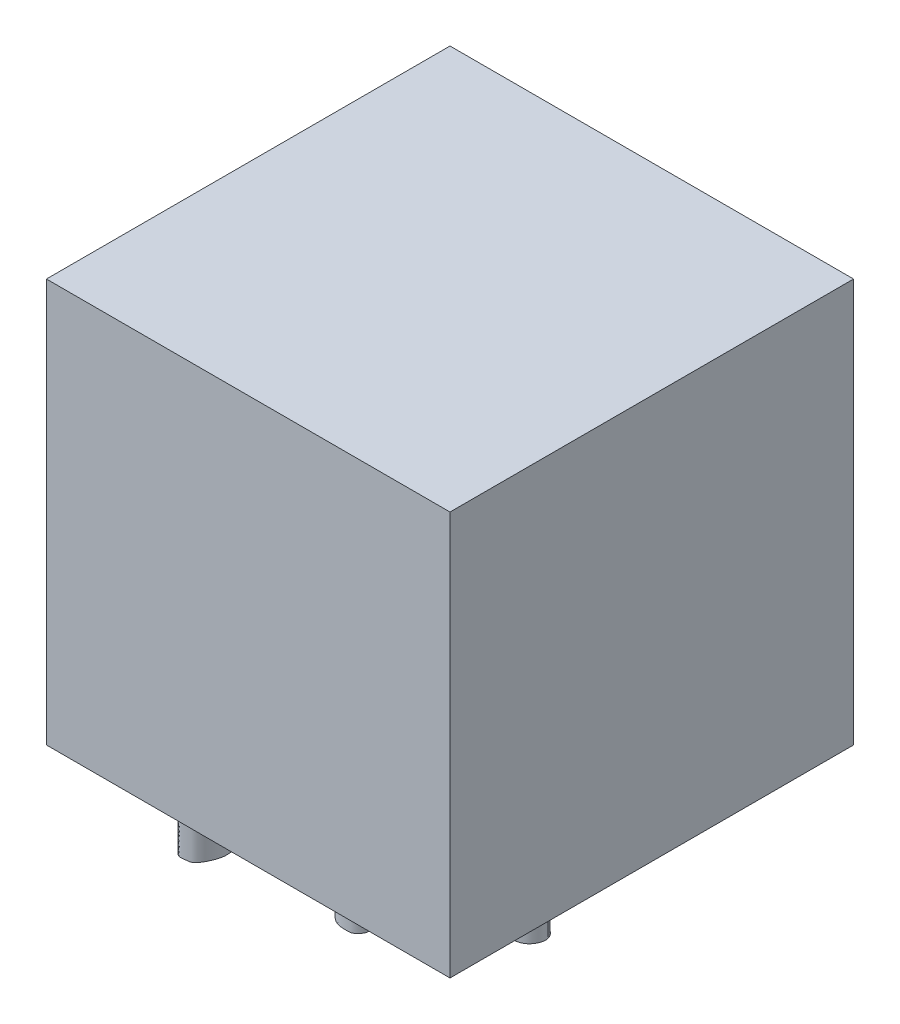
from build123d import *

# Parameters (mm, degrees)
SKETCH_1_W      = 30
SKETCH_1_H      = 30
EXTRUDE_1_DEPTH = 30
EXTRUDE_2_DEPTH = 3


with BuildPart() as part:
    # 草图1 → 凸台-拉伸1 (new body)
    with BuildSketch(Plane(origin=(0, 0, 0), x_dir=(1, 0, 0), z_dir=(0, 1, 0))):
        Rectangle(SKETCH_1_W, SKETCH_1_H)
    extrude(amount=EXTRUDE_1_DEPTH)

    # 草图2 → 凸台-拉伸2 (add)
    with BuildSketch(Plane.XZ):
        with BuildLine():
            add(Edge.make_bspline(
                [(-6.194597654, 13.82502505), (-6.166933702, 13.744211153), (-6.000916232, 13.631687004), (-5.771694041, 13.669888057), (-5.642382478, 13.506764366), (-5.427894123, 13.354814494), (-5.332082009, 12.99438775), (-5.203476733, 12.369186598), (-5.306627094, 11.403341407), (-5.456334531, 10.230728777), (-5.69960307, 9.09337539), (-5.932822276, 8.41426922), (-6.199867158, 7.999028357), (-6.40280031, 8.038345758), (-6.658277331, 7.995079883), (-7.021426722, 8.076449659), (-7.408439024, 8.027505013), (-7.71414718, 8.149523486), (-7.910002864, 8.058406525), (-8.079553236, 7.865646365), (-7.766876379, 7.762054775), (-7.473766919, 7.707967411), (-7.165725242, 7.463411988), (-6.686308156, 7.218412088), (-6.553977908, 6.662707223), (-6.773906248, 6.218736262), (-7.054140966, 5.763318364), (-7.35646497, 5.135256464), (-7.79101034, 4.440855154), (-8.141326234, 3.80352888), (-8.453730811, 3.338516564), (-8.807257688, 3.082811933), (-9.235826196, 3.284913926), (-9.574093218, 3.705609094), (-9.967244453, 3.893145757), (-10.117707695, 4.150088136), (-10.244248681, 4.080005387), (-10.278441945, 3.90990159), (-10.247445324, 3.581433709), (-10.116633768, 3.142025815), (-9.840949534, 2.695292524), (-9.826676945, 2.308098648), (-9.660812888, 1.985966336), (-9.98152047, 1.717987945), (-10.329139679, 1.423013606), (-10.647244937, 1.186169371), (-11.046705043, 0.790563905), (-10.677502971, 0.612401642), (-10.443443385, 0.487834453), (-10.154166276, 0.525237776), (-9.822886914, 0.551367922), (-9.496991679, 0.227987567), (-9.148977333, -0.43254628), (-9.163447934, -1.145586179), (-8.938423635, -2.001110377), (-9.463078147, -2.114888415), (-9.809303687, -2.203570605), (-10.136635919, -2.35927749), (-10.129903178, -2.637230759), (-9.954372946, -2.686217099), (-9.751809786, -2.785910936), (-9.378900775, -2.90802814), (-8.856952618, -3.017926375), (-8.759285569, -3.467117867), (-8.552359583, -3.793398262), (-8.46512258, -4.284885027), (-8.119154468, -4.834779617), (-7.939798671, -5.405367708), (-7.845847443, -6.035717775), (-8.264066, -6.229288393), (-8.631448752, -6.374278601), (-9.231140993, -6.685045066), (-10.045445895, -6.865500005), (-11.249329146, -7.065405221), (-12.067979179, -7.064348304), (-12.664933891, -6.935664624), (-12.740474345, -6.971518249), (-12.780390741, -7.149088085), (-12.601383915, -7.574188695), (-11.96505044, -7.934579051), (-11.29775327, -8.300953559), (-10.524197589, -8.508402808), (-9.842539709, -8.466003224), (-9.257832147, -8.242855041), (-8.807518164, -7.978837434), (-8.173374363, -7.776188679), (-7.491653299, -7.377469808), (-6.807216647, -7.103705575), (-6.344395961, -6.861706979), (-5.984626323, -6.756735219), (-5.582898489, -6.86426538), (-5.605892151, -7.24830518), (-5.5999728, -7.522364328), (-5.614315179, -7.852513786), (-5.703867545, -8.321985229), (-5.851593241, -9.565379572), (-5.972792626, -10.65891775), (-6.076231028, -11.565599756), (-6.045766962, -11.76827466), (-5.835111542, -12.03502697), (-5.685966964, -12.446727592), (-5.399912486, -12.813197018), (-5.171302302, -13.23933345), (-4.854248504, -13.638000637), (-4.51346938, -13.854326775), (-4.235300898, -14.004832455), (-3.945258152, -14.024213162), (-3.734927676, -13.764521717), (-3.444940716, -13.284633186), (-3.364280549, -12.624026048), (-3.231978731, -11.790548051), (-3.230859014, -10.93515259), (-3.163879886, -10.047119808), (-3.245078415, -9.180654768), (-3.37802795, -8.406620358), (-3.576936642, -7.527854267), (-3.861463635, -6.834989824), (-4.036095467, -6.339665147), (-4.147527225, -6.088925148), (-4.119643189, -5.825720234), (-3.848864078, -5.800251621), (-3.499814375, -5.748214262), (-2.880252956, -5.681696951), (-2.121394652, -5.712537659), (-1.266757365, -5.615732831), (-0.732590037, -5.564201796), (-0.259994989, -5.632947858), (-0.205004786, -5.856779439), (-0.327034371, -6.071932984), (-0.484683105, -6.31199922), (-0.575590818, -6.644671473), (-0.748358617, -6.980639557), (-0.974777917, -7.371346613), (-1.106554189, -7.876762175), (-1.038283756, -8.459132222), (-0.622975531, -8.873595365), (-0.114707859, -9.076631683), (0.449611088, -9.117794748), (0.705855062, -8.791435887), (0.951526965, -8.595088559), (0.851321032, -8.254071448), (1.127726862, -8.096330877), (1.322216748, -7.865973786), (1.644448221, -7.823632382), (1.978324041, -7.622496103), (2.383710898, -7.604060731), (2.879277104, -7.557337459), (3.343468395, -7.566472921), (3.774197453, -7.534151247), (4.014752582, -7.688347491), (4.150953267, -7.880498249), (4.132733249, -8.148578677), (4.139313388, -8.484434885), (4.13557898, -8.969102421), (4.142554089, -9.635778444), (4.165076703, -10.381573602), (4.039026879, -11.014741974), (4.13971349, -11.530769596), (4.2651726, -12.121192387), (4.187022266, -12.778609282), (4.50331136, -13.746970421), (5.220877365, -13.348891922), (5.515886272, -12.857023511), (5.755203331, -12.219523288), (6.004746, -11.451790418), (5.977600719, -10.637550685), (5.983888264, -9.931314098), (5.978160796, -9.36403182), (5.998218316, -8.833683633), (5.973799821, -8.328108543), (5.998906019, -7.873287902), (6.203933032, -7.565797825), (6.531254331, -7.333142752), (6.978268447, -7.399549886), (7.571264098, -7.449570124), (8.27585404, -7.443274343), (9.059692784, -7.43760105), (9.980755733, -7.576211121), (10.867686162, -7.687500436), (11.91261484, -6.988306695), (11.155045831, -5.809710678), (10.281058911, -5.467144787), (9.640182684, -5.028135677), (8.825738944, -4.779311018), (7.931801944, -5.0397386), (7.104711236, -5.165937877), (6.648631927, -5.614132015), (6.314731237, -5.527836745), (6.081520317, -5.361781023), (6.083612045, -5.014441969), (6.031470145, -4.634365059), (6.397426857, -4.414637784), (6.826949343, -4.292758047), (7.402256694, -4.274739039), (7.959503799, -4.128662501), (8.678156327, -3.956245356), (9.220880636, -3.665230548), (9.914158513, -3.205131151), (9.431450323, -2.601097871), (8.866123161, -2.206700457), (7.873375064, -2.004634249), (7.084964306, -2.196000182), (6.438526392, -2.089541068), (6.234131895, -1.832122755), (6.161307576, -1.56759109), (6.181999877, -1.287163308), (6.444371105, -0.966815671), (6.947570136, -1.048703896), (7.473638942, -0.993252584), (8.040616738, -0.98009558), (8.657697388, -0.772071049), (8.755442971, -0.261381287), (8.738908581, 0.075909023), (8.502973434, 0.357154061), (8.848154759, 0.687268439), (9.1354908, 1.006085252), (9.577227319, 1.375001858), (9.886632107, 1.871243057), (10.306610932, 2.3200709), (10.375622035, 2.89053594), (10.382124635, 3.454090686), (9.906248078, 3.824778141), (9.318959611, 4.165783224), (8.247804165, 3.941360112), (7.1151563, 3.887788649), (6.351738876, 3.01074388), (5.835530956, 3.217409366), (5.605980655, 3.528477481), (5.810564926, 4.048480321), (6.287195337, 4.279750098), (6.745260436, 4.552423078), (7.356803764, 4.698255871), (8.28629638, 4.787965098), (9.455209848, 4.772660016), (10.711313901, 4.896512103), (11.973415449, 4.762871752), (13.463066306, 5.610707933), (12.845166255, 6.972950426), (11.746001331, 7.301901356), (10.715332584, 7.096357819), (9.568952666, 6.879409459), (8.742944499, 6.597327849), (8.154109837, 6.499987823), (7.811730858, 6.355546658), (7.564841767, 6.595544528), (7.661220331, 7.073691174), (8.073630292, 7.66084157), (8.489771176, 8.461897139), (8.576146649, 9.60622319), (7.792779728, 9.879289944), (7.187368256, 10.067147154), (6.697558809, 9.837558655), (6.213456754, 9.719961607), (5.80588025, 9.986470745), (5.934460053, 10.471619368), (5.911108875, 10.956754535), (5.842224988, 11.542256526), (6.070103462, 12.090367837), (5.764837891, 12.523069325), (5.483519021, 12.802619626), (5.074561208, 12.777786198), (4.749203818, 12.790251317), (4.388811852, 12.724366481), (4.00364226, 12.551079414), (3.640160913, 12.18918798), (3.439789446, 11.645341806), (3.513337864, 11.121085773), (3.660568731, 10.676290933), (3.740598298, 10.239160623), (3.843723173, 9.787373394), (3.923376969, 9.388624394), (4.017089433, 9.022603352), (3.754528253, 8.798853149), (3.25886713, 8.574118049), (2.586189931, 8.422808762), (1.91805335, 8.277548674), (1.392337963, 8.132128088), (1.012976546, 8.667296033), (0.600448519, 7.990354485), (0.748860461, 7.48553453), (0.9957295, 7.009595498), (1.391348303, 6.726865747), (1.78971893, 6.528421513), (2.293155627, 6.546374423), (2.763008187, 6.934326014), (3.351353506, 7.089108461), (3.728143186, 7.45571962), (4.142713122, 7.334637491), (4.116099549, 6.929457735), (4.196279075, 6.563659888), (4.085775219, 6.157784648), (4.049795581, 5.468883502), (2.900554072, 5.140239517), (1.608301567, 4.693652516), (0.170091832, 5.110046294), (-1.030497776, 5.345802754), (-2.06399715, 4.915729909), (-3.360171711, 4.202914933), (-4.777874094, 3.70070588), (-5.581005416, 2.845130201), (-6.073806369, 2.947185469), (-5.978921963, 3.460869305), (-5.816938608, 4.002006589), (-5.513175229, 4.868725446), (-5.263999308, 5.718534328), (-4.976645998, 6.407828215), (-4.822071282, 6.774637256), (-4.624022597, 7.049184368), (-4.295088439, 6.992779867), (-3.954927999, 7.115690782), (-3.387790398, 7.199333966), (-2.21365989, 7.490319303), (-0.642008242, 7.741593119), (-0.397085276, 8.875027977), (-0.683427256, 9.173059778), (-1.231370235, 9.291265535), (-1.970297062, 9.464242673), (-2.50105436, 9.33675467), (-2.922833404, 9.421413443), (-2.86673727, 9.137851507), (-3.021884422, 8.943244305), (-3.225164748, 8.580750154), (-3.679007239, 8.496546337), (-4.083951837, 8.324609704), (-4.491157586, 8.514262766), (-4.394054373, 8.885091418), (-4.438512242, 9.315553211), (-4.258163938, 9.77981077), (-4.328711978, 10.384380791), (-4.14774873, 11.049490156), (-4.279019707, 11.808382905), (-4.172013427, 12.571289617), (-4.417981527, 13.286506847), (-4.687567902, 13.840573929), (-5.062843459, 14.20368288), (-5.495757997, 14.217343286), (-5.980060042, 14.33492593), (-6.235537011, 13.944620002), (-6.194597654, 13.82502505)],
                knots=[0, 0, 0, 0, 0.00143529, 0.002548151, 0.003409122, 0.004493819, 0.00670807, 0.008937409, 0.014777932, 0.021805679, 0.027976192, 0.032810478, 0.034083375, 0.034660807, 0.035884856, 0.038223119, 0.040416701, 0.042074847, 0.043014583, 0.043859723, 0.045237125, 0.046530569, 0.049138886, 0.051091234, 0.055040039, 0.05637844, 0.058952251, 0.063539179, 0.067437988, 0.071982219, 0.075047105, 0.076449976, 0.078366654, 0.0816561, 0.085072715, 0.085375831, 0.085760831, 0.08688216, 0.087988219, 0.091018125, 0.094101482, 0.096079221, 0.097170926, 0.099352634, 0.101439017, 0.104679756, 0.106445559, 0.108110986, 0.109570239, 0.110862154, 0.112599808, 0.11460135, 0.117625732, 0.12424519, 0.126821601, 0.129058445, 0.131138398, 0.133100904, 0.134000879, 0.134647492, 0.135731396, 0.137676748, 0.141001347, 0.143039702, 0.144404965, 0.147153813, 0.150798701, 0.154496635, 0.157058332, 0.159605881, 0.160754132, 0.163486129, 0.170220498, 0.173912365, 0.182893917, 0.183153912, 0.183408706, 0.184129373, 0.185700457, 0.190480032, 0.19510784, 0.19793879, 0.203091046, 0.205624996, 0.20784257, 0.211365391, 0.216144534, 0.220334693, 0.223105195, 0.224367858, 0.226364898, 0.228425515, 0.229564992, 0.230859918, 0.233629907, 0.237170988, 0.250750457, 0.251177543, 0.251638011, 0.253965151, 0.256373819, 0.258568056, 0.261287118, 0.264072788, 0.266545755, 0.267621137, 0.269142566, 0.270649319, 0.272559304, 0.278153945, 0.280856442, 0.286035026, 0.291696787, 0.294994466, 0.299836819, 0.304191085, 0.309273479, 0.31174869, 0.312489675, 0.313695353, 0.315206095, 0.316096879, 0.319490996, 0.324939073, 0.328269717, 0.332926882, 0.334198345, 0.334737541, 0.33628701, 0.337894838, 0.339348102, 0.341702928, 0.343893998, 0.346499154, 0.34992585, 0.352638265, 0.355311308, 0.358805336, 0.360265523, 0.36178731, 0.363387685, 0.364796653, 0.366262221, 0.368140923, 0.369648852, 0.372400114, 0.374397628, 0.377586055, 0.379875266, 0.380950417, 0.381995242, 0.383448222, 0.385042024, 0.387396504, 0.391127626, 0.395656052, 0.399253795, 0.40119535, 0.403988264, 0.408631707, 0.412765708, 0.415591084, 0.418938703, 0.422170619, 0.426317918, 0.431690686, 0.434954719, 0.437574535, 0.440710019, 0.443373129, 0.44566913, 0.447777513, 0.449016317, 0.451852173, 0.454437973, 0.458647077, 0.462985655, 0.466879721, 0.473498701, 0.476832347, 0.484148283, 0.488788681, 0.492510033, 0.49633331, 0.501878827, 0.506875099, 0.509658412, 0.510790509, 0.512100942, 0.513850955, 0.516029933, 0.517519846, 0.520005545, 0.523260015, 0.526527585, 0.529198474, 0.534818117, 0.537220529, 0.540095335, 0.544353936, 0.548953721, 0.555345392, 0.557341384, 0.558793139, 0.560283052, 0.561643664, 0.563126815, 0.566254762, 0.568836341, 0.571671242, 0.575478711, 0.577693791, 0.579318467, 0.580885239, 0.582524542, 0.585644418, 0.58829397, 0.591424071, 0.594995502, 0.597651296, 0.600442928, 0.603346906, 0.606586054, 0.610977495, 0.619919548, 0.624469699, 0.626499929, 0.627839085, 0.630229041, 0.634019694, 0.636117265, 0.638682505, 0.643904176, 0.650955085, 0.657289205, 0.663760662, 0.671649874, 0.678354618, 0.681578063, 0.689444215, 0.694572685, 0.700269317, 0.703097542, 0.704315147, 0.705696682, 0.70752915, 0.71146459, 0.717104035, 0.722345951, 0.726516783, 0.728730425, 0.732307087, 0.734678234, 0.736369579, 0.738925875, 0.741560514, 0.744314246, 0.748298306, 0.749728063, 0.752504443, 0.754040054, 0.756006596, 0.757726499, 0.759802812, 0.762638977, 0.765649176, 0.768650372, 0.770854214, 0.773106291, 0.7757209, 0.778135023, 0.779867021, 0.781007387, 0.783170508, 0.788674882, 0.791660581, 0.79445279, 0.796340702, 0.799644768, 0.802147267, 0.805054244, 0.807854746, 0.80973938, 0.812060768, 0.815368576, 0.819062635, 0.8217005, 0.822993981, 0.824760016, 0.827203109, 0.829116648, 0.831360816, 0.837531517, 0.844684949, 0.853847278, 0.860393098, 0.863462795, 0.871334394, 0.884010538, 0.887326186, 0.888644391, 0.890565917, 0.893916081, 0.898504975, 0.904766612, 0.908148026, 0.910283441, 0.91121261, 0.913198625, 0.914833657, 0.917027782, 0.922196723, 0.93488548, 0.937093542, 0.93845428, 0.94094187, 0.945913744, 0.949939747, 0.950548288, 0.951396068, 0.95322169, 0.954663737, 0.95772475, 0.959918875, 0.961701378, 0.963339757, 0.965212775, 0.968729823, 0.970858429, 0.97477863, 0.979444854, 0.982914561, 0.986832488, 0.991182874, 0.99274231, 0.994745422, 0.997875941, 1, 1, 1, 1], degree=3))
        make_face()
        with BuildLine():
            add(Edge.make_bspline(
                [(-7.125659856, -3.364407387), (-7.154167063, -3.660548144), (-6.991904122, -4.242237995), (-6.730272364, -4.88241137), (-6.471626483, -5.374440939), (-6.099774286, -5.38952021), (-6.046205189, -5.043403378), (-5.843748918, -4.696696691), (-6.027141466, -4.170194717), (-6.281489822, -3.640659427), (-6.518477192, -3.236356047), (-6.772058347, -2.888916472), (-7.065322323, -3.045353242), (-7.113306973, -3.236082219), (-7.125659856, -3.364407387)],
                knots=[0, 0, 0, 0, 0.153339667, 0.311025389, 0.387357303, 0.416552655, 0.481778789, 0.533887522, 0.632613162, 0.748793447, 0.848327043, 0.902576129, 0.933554102, 1, 1, 1, 1], degree=3))
        make_face(mode=Mode.SUBTRACT)
        with BuildLine():
            add(Edge.make_bspline(
                [(-6.020689413, -2.588622592), (-6.00713528, -2.644212148), (-5.944868369, -2.758689746), (-5.749660858, -2.76020705), (-5.541895063, -2.75723362), (-5.338229008, -2.771518412), (-5.105292195, -2.729016667), (-4.937223703, -2.579504031), (-4.623368903, -2.445030723), (-4.365888402, -2.221088168), (-4.081966435, -2.038706265), (-4.014821736, -1.84466979), (-3.853715798, -1.77718679), (-3.907621159, -1.606574208), (-4.079643158, -1.677173702), (-4.319480273, -1.635614042), (-4.595496909, -1.887284258), (-4.961914551, -1.819528108), (-5.214411557, -2.017666117), (-5.498348238, -2.103740275), (-5.730693292, -2.262554372), (-6.019619799, -2.320945504), (-6.040964239, -2.505469465), (-6.020689413, -2.588622592)],
                knots=[0, 0, 0, 0, 0.030787309, 0.06971855, 0.101804429, 0.15568237, 0.188081219, 0.237128634, 0.283318721, 0.386450883, 0.437675982, 0.473312614, 0.501919751, 0.522013804, 0.548601162, 0.58820216, 0.666273925, 0.738527795, 0.786500868, 0.846305182, 0.910002555, 0.953947087, 1, 1, 1, 1], degree=3))
        make_face(mode=Mode.SUBTRACT)
        with BuildLine():
            add(Edge.make_bspline(
                [(2.047129676, -4.120929979), (1.9705708, -4.200031487), (1.90887329, -4.485915456), (1.650363291, -4.878053833), (1.747107141, -5.399185749), (1.613970099, -5.781073217), (1.71361674, -6.108113306), (1.913057583, -6.45226986), (2.287031641, -6.181436129), (2.660685496, -6.309295277), (2.888058365, -6.008418935), (3.188259008, -6.096433918), (3.476142724, -5.939124522), (3.756938799, -5.864108659), (3.97864635, -5.673297903), (4.101268041, -5.536533994), (4.290379168, -5.322390564), (4.083868982, -5.070514419), (4.076242983, -4.742396628), (3.809630302, -4.721050201), (3.655792057, -4.514688056), (3.388949433, -4.664936756), (3.100467643, -4.641241039), (2.847505929, -4.555241487), (2.613735335, -4.45945211), (2.467735488, -4.326580376), (2.26273776, -4.261366002), (2.18946762, -4.005407707), (2.074104909, -4.09305886), (2.047129676, -4.120929979)],
                knots=[0, 0, 0, 0, 0.038333708, 0.114035775, 0.168067669, 0.235211813, 0.258899369, 0.30209022, 0.356422376, 0.393894839, 0.440454657, 0.471681709, 0.501820444, 0.562438264, 0.582057887, 0.612349744, 0.636098452, 0.67967702, 0.717590455, 0.74106278, 0.76956913, 0.801626107, 0.83936735, 0.880490848, 0.903672855, 0.936091101, 0.954042995, 0.986493262, 1, 1, 1, 1], degree=3))
        make_face(mode=Mode.SUBTRACT)
        with BuildLine():
            add(Edge.make_bspline(
                [(3.048842696, -1.710152022), (2.976907144, -1.789093199), (2.818615599, -1.959087458), (2.610907282, -2.201110143), (2.383565424, -2.396837336), (2.26949581, -2.621271448), (2.14752259, -2.851816466), (2.157805467, -3.117297026), (2.33311394, -3.263641606), (2.4092871, -3.468844098), (2.611630587, -3.518506314), (2.731788216, -3.646055481), (2.905840979, -3.673480904), (3.127669593, -3.694092718), (3.378749276, -3.729232977), (3.553801924, -3.610700226), (3.651166983, -3.511723161), (3.689275301, -3.394637395), (3.679112299, -3.252397779), (3.659998438, -3.071627825), (3.574748602, -2.883112428), (3.532670904, -2.666922345), (3.516534061, -2.436260599), (3.617707743, -2.235644411), (3.653080279, -2.061949137), (3.653946205, -1.899016432), (3.612793804, -1.715516951), (3.445240877, -1.586088008), (3.256570301, -1.57065233), (3.126753669, -1.624273894), (3.068713804, -1.688345715), (3.048842696, -1.710152022)],
                knots=[0, 0, 0, 0, 0.054070265, 0.118111876, 0.162023254, 0.204593802, 0.244024933, 0.295770056, 0.320734156, 0.357172655, 0.39871861, 0.416747319, 0.443988399, 0.483623485, 0.533483976, 0.564463664, 0.587058737, 0.602810801, 0.625197572, 0.658834969, 0.694585953, 0.728926388, 0.770918623, 0.808243743, 0.840706729, 0.860020165, 0.890985228, 0.932850301, 0.956285693, 0.985063907, 1, 1, 1, 1], degree=3))
        make_face(mode=Mode.SUBTRACT)
        with BuildLine():
            add(Edge.make_bspline(
                [(1.398889956, 3.479003743), (1.33358006, 3.461272505), (1.2136027, 3.385233549), (1.103602558, 3.24015866), (0.980553364, 3.127630869), (0.928681101, 3.005163652), (0.836955678, 2.899248254), (0.795342992, 2.74237416), (0.745274064, 2.558167298), (0.765255564, 2.384106188), (0.737155358, 2.114558072), (0.974059704, 2.252680657), (1.035048732, 2.424779516), (1.230188967, 2.489475061), (1.292889692, 2.654757076), (1.468598068, 2.719391826), (1.520122311, 2.890524932), (1.626063955, 2.962885086), (1.688708008, 3.039676269), (1.722418583, 3.110417974), (1.761452847, 3.186495667), (1.737630152, 3.277781685), (1.649617662, 3.329639597), (1.59548699, 3.411759586), (1.519532682, 3.497837039), (1.438731706, 3.489820534), (1.398889956, 3.479003743)],
                knots=[0, 0, 0, 0, 0.055712068, 0.120324734, 0.15552547, 0.197469241, 0.232771925, 0.273922428, 0.335975857, 0.389486792, 0.445789802, 0.487512146, 0.557005651, 0.609571749, 0.643621127, 0.700134205, 0.754236226, 0.784453415, 0.808250641, 0.838616193, 0.851961648, 0.880893303, 0.908073746, 0.936831401, 0.966013325, 1, 1, 1, 1], degree=3))
        make_face(mode=Mode.SUBTRACT)
        with BuildLine():
            add(Edge.make_bspline(
                [(6.253241902, 8.882971749), (6.249240022, 8.826534655), (6.107360507, 8.811592901), (6.078480497, 8.667149726), (5.962652483, 8.587652565), (5.951712042, 8.396867012), (5.908068583, 8.238262954), (5.914066637, 8.083298412), (5.91298528, 7.976992144), (5.913190636, 7.873734118), (5.913411236, 7.767840477), (5.912297482, 7.66938731), (5.915326573, 7.582126588), (5.905396799, 7.49728183), (5.952452561, 7.429735851), (5.979235468, 7.310023554), (6.162428665, 7.341583782), (6.276816407, 7.445841636), (6.377640691, 7.579149863), (6.466594873, 7.695688349), (6.535797189, 7.814254962), (6.631749049, 7.921110493), (6.717328907, 8.036974517), (6.79831213, 8.152994909), (6.831022336, 8.292425256), (6.919221106, 8.407438581), (6.972383254, 8.544027704), (7.005872083, 8.662615965), (7.013253403, 8.775765162), (7.037768826, 8.893547962), (6.987622644, 9.001484008), (6.889578016, 9.081451455), (6.750724241, 9.109661697), (6.604131506, 9.090489162), (6.450548214, 9.052109709), (6.332308856, 9.006607794), (6.248640767, 8.930945533), (6.253761268, 8.890296189), (6.253241902, 8.882971749)],
                knots=[0, 0, 0, 0, 0.038756581, 0.057603149, 0.090651506, 0.121717005, 0.175449854, 0.199048987, 0.222221266, 0.244981301, 0.266417693, 0.291418366, 0.309051417, 0.32393738, 0.345014892, 0.361663538, 0.395465309, 0.43383647, 0.467846127, 0.50296263, 0.52988898, 0.557080526, 0.596353234, 0.624295659, 0.648310242, 0.688357757, 0.71699831, 0.743691294, 0.768323716, 0.791127055, 0.820683044, 0.840039797, 0.872326604, 0.90932995, 0.936384777, 0.974775705, 0.994970147, 1, 1, 1, 1], degree=3))
        make_face(mode=Mode.SUBTRACT)
        with BuildLine():
            add(Edge.make_bspline(
                [(2.26651839, 3.269592796), (2.149855899, 3.22440226), (1.957752512, 3.071366435), (1.878851459, 2.736508149), (1.879430961, 2.368186555), (1.982154231, 2.033662907), (2.257702525, 1.724844378), (1.963136863, 1.449639589), (2.104939988, 1.032492877), (2.300520919, 0.581810168), (2.369403575, 0.02865555), (2.524792758, -0.439536016), (2.806108589, -0.788453137), (3.342623906, -0.773073073), (3.802314486, -0.662114684), (4.344444459, -0.546483674), (4.738196946, -0.435900625), (5.216837795, -0.262093728), (5.702631252, -0.159889565), (6.196987572, 0.036143777), (6.571176427, 0.373894738), (6.889564331, 0.686030461), (7.155474725, 1.060339327), (7.466229648, 1.358629248), (7.74237432, 1.735364326), (8.012353837, 2.080340708), (7.993950322, 2.405119528), (7.935048015, 2.825934854), (7.559144778, 2.443220329), (7.141891588, 2.423203217), (6.698436953, 2.142359453), (6.056652938, 2.050016492), (5.376607087, 1.831891464), (4.432304601, 1.645899481), (3.67663022, 1.899633071), (2.958485178, 1.672459587), (2.762672, 2.067870379), (3.059242089, 2.307580963), (3.368289606, 2.185917734), (3.629180166, 2.306989084), (3.858417375, 2.355607005), (4.030754119, 2.520860019), (4.219228815, 2.770267886), (4.140959328, 3.115916443), (4.177219898, 3.435239164), (4.011585581, 3.575735824), (4.034895705, 3.729004473), (3.79848565, 3.829859101), (3.457734144, 3.807677006), (3.075207754, 3.606861892), (2.66830485, 3.538286039), (2.468744936, 3.322560822), (2.325252796, 3.292344233), (2.26651839, 3.269592796)],
                knots=[0, 0, 0, 0, 0.017519177, 0.032024959, 0.047456611, 0.069313519, 0.083007787, 0.096431922, 0.115088591, 0.139208059, 0.168544061, 0.192675844, 0.210096647, 0.226829667, 0.263959084, 0.279154098, 0.305454475, 0.32218079, 0.351499975, 0.37618966, 0.396561272, 0.422663379, 0.439544736, 0.461779235, 0.483267641, 0.507657841, 0.518213618, 0.53264851, 0.549333973, 0.568953544, 0.595956987, 0.619926319, 0.660746154, 0.698164568, 0.753205127, 0.775284822, 0.788500434, 0.800675042, 0.818998878, 0.831079068, 0.840359273, 0.85179073, 0.864262365, 0.882555893, 0.899433826, 0.907005055, 0.909268555, 0.92013824, 0.934217329, 0.960328292, 0.979476797, 0.991179869, 1, 1, 1, 1], degree=3))
        make_face(mode=Mode.SUBTRACT)
        with BuildLine():
            add(Edge.make_bspline(
                [(0.515273747, 1.473175562), (0.396447113, 1.461170672), (0.1808646, 1.448383078), (-0.096340017, 0.911714132), (-0.298289402, 0.257745628), (-1.307086736, -0.549223733), (-2.077527435, -1.964523552), (-3.762373766, -2.698507796), (-4.552217425, -3.568920259), (-5.35680784, -3.730933295), (-5.327085448, -4.150540582), (-5.096818055, -4.418829794), (-4.91422218, -4.817299004), (-4.406662161, -4.768407885), (-3.825337905, -4.433380031), (-2.979492984, -4.099840841), (-2.000103416, -3.96060117), (-1.098368312, -4.00155671), (-0.61609282, -4.470359726), (0.057881777, -4.359703433), (-0.055662244, -4.884688758), (0.464068537, -4.364755506), (0.507619445, -3.958398223), (0.671085411, -3.385323427), (1.154552816, -2.965142661), (1.373830467, -2.44057977), (1.8546756, -1.96307805), (1.372660333, -1.532913238), (1.056622839, -1.087312798), (0.719967536, -0.396053631), (0.580373107, 0.382598243), (0.220350283, 1.06939486), (0.801156099, 1.505619371), (0.587386066, 1.48046097), (0.515273747, 1.473175562)],
                knots=[0, 0, 0, 0, 0.013340419, 0.032026241, 0.073768758, 0.110467983, 0.205115382, 0.290660641, 0.352531002, 0.372108864, 0.385959729, 0.400489681, 0.4232323, 0.4372677, 0.464103392, 0.517898802, 0.560569184, 0.603489419, 0.633298467, 0.656554065, 0.664070536, 0.686575572, 0.70618268, 0.733491688, 0.762566869, 0.791873286, 0.816438309, 0.837137102, 0.86577166, 0.897049335, 0.940525403, 0.979098936, 0.9919041, 1, 1, 1, 1], degree=3))
        make_face(mode=Mode.SUBTRACT)
        with BuildLine():
            add(Edge.make_bspline(
                [(-7.633851704, -0.075511329), (-7.822060376, -0.11241712), (-7.855370693, -0.752210432), (-7.550463597, -1.06683498), (-7.614986191, -1.709563666), (-6.831173091, -1.263274013), (-6.261894569, -1.144419477), (-5.614145912, -1.101228264), (-5.131534531, -0.648956206), (-4.548730892, -0.683385094), (-4.131714716, -0.496747413), (-3.711014477, -0.367773282), (-3.321338334, -0.401801823), (-2.801555023, -0.451138294), (-2.378275788, -0.10516833), (-2.082115638, 0.33952362), (-1.77988141, 0.704437986), (-1.595105139, 1.097092339), (-1.408692675, 1.492614912), (-1.238495756, 1.891407012), (-1.06512834, 2.355547999), (-1.394249768, 2.627635516), (-1.60253341, 2.959542213), (-2.026597451, 2.934175864), (-2.347854597, 3.414518407), (-2.944212131, 2.889611582), (-3.540332856, 2.81829868), (-4.111418536, 2.497636908), (-4.81893564, 2.319843267), (-5.483608175, 2.357714583), (-5.998160061, 2.110381692), (-6.380150919, 2.343022247), (-6.811206665, 2.008548785), (-7.126531113, 1.721118482), (-7.434997212, 1.354819244), (-7.657720666, 1.130849285), (-7.844903671, 0.715296781), (-7.299255018, 0.578808032), (-6.879044242, 0.554984118), (-6.436940353, 0.788926612), (-5.9648028, 0.798441738), (-5.667889021, 1.227657704), (-5.204714601, 1.416692805), (-4.717853506, 1.586013565), (-4.235660448, 1.798871543), (-3.734282497, 2.079588303), (-3.191052266, 1.847368132), (-3.105073117, 1.491546466), (-3.086556118, 1.141879457), (-3.413086013, 0.85409479), (-3.616569976, 0.293340875), (-4.266624633, 0.35355288), (-4.704136211, -0.025100364), (-5.220316033, -0.242108203), (-5.812913719, -0.456339747), (-6.359506166, -0.45003996), (-6.842809125, -0.519050149), (-7.118521868, -0.297739688), (-7.355135364, -0.138078875), (-7.563930591, -0.061800515), (-7.633851704, -0.075511329)],
                knots=[0, 0, 0, 0, 0.023974182, 0.040069344, 0.051006543, 0.077359533, 0.096620893, 0.122914877, 0.14109064, 0.163500789, 0.181005162, 0.189631327, 0.210031183, 0.222260999, 0.24384169, 0.262853723, 0.280252675, 0.293780176, 0.30908374, 0.326328162, 0.342424773, 0.353921577, 0.368213251, 0.381470881, 0.393847871, 0.419363359, 0.442739975, 0.461121858, 0.487562943, 0.519644814, 0.53117787, 0.544950831, 0.560239981, 0.582465366, 0.592767021, 0.610369986, 0.618482376, 0.633442788, 0.653584384, 0.667199099, 0.685008521, 0.700207148, 0.718824697, 0.737239007, 0.755318026, 0.775357193, 0.796305954, 0.805695403, 0.813316837, 0.832277613, 0.848623056, 0.870739792, 0.88984288, 0.908935811, 0.930286972, 0.956096969, 0.967586967, 0.980035165, 0.991093389, 1, 1, 1, 1], degree=3))
        make_face(mode=Mode.SUBTRACT)
    extrude(amount=EXTRUDE_2_DEPTH)


solid = part.part
